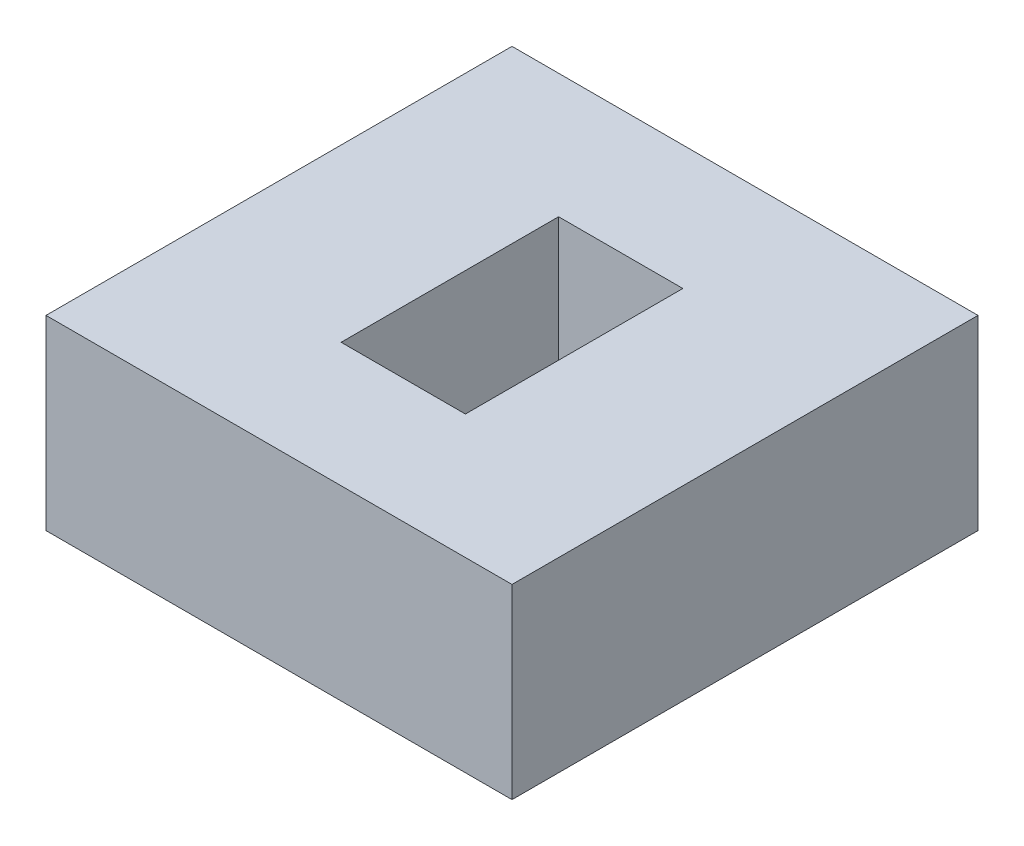
from build123d import *

# Parameters (mm, degrees)
SKETCH1_W           = 75
SKETCH1_H           = 75
BOSS_EXTRUDE1_DEPTH = 30
SKETCH2_W           = 20
SKETCH2_H           = 35
CUT_EXTRUDE1_DEPTH  = 111.227038425


with BuildPart() as part:
    # Sketch1 → Boss-Extrude1 (new body)
    with BuildSketch(Plane(origin=(0, 0, 0), x_dir=(1, 0, 0), z_dir=(0, 1, 0))):
        with Locations((37.5, 37.5)):
            Rectangle(SKETCH1_W, SKETCH1_H)
    extrude(amount=BOSS_EXTRUDE1_DEPTH)

    # Sketch2 → Cut-Extrude1 (cut, through all)
    with BuildSketch(Plane(origin=(0, 30, 0), x_dir=(1, 0, 0), z_dir=(0, 1, 0))):
        with Locations((37.5, 37.5)):
            Rectangle(SKETCH2_W, SKETCH2_H)
    extrude(amount=-CUT_EXTRUDE1_DEPTH, mode=Mode.SUBTRACT)


solid = part.part
